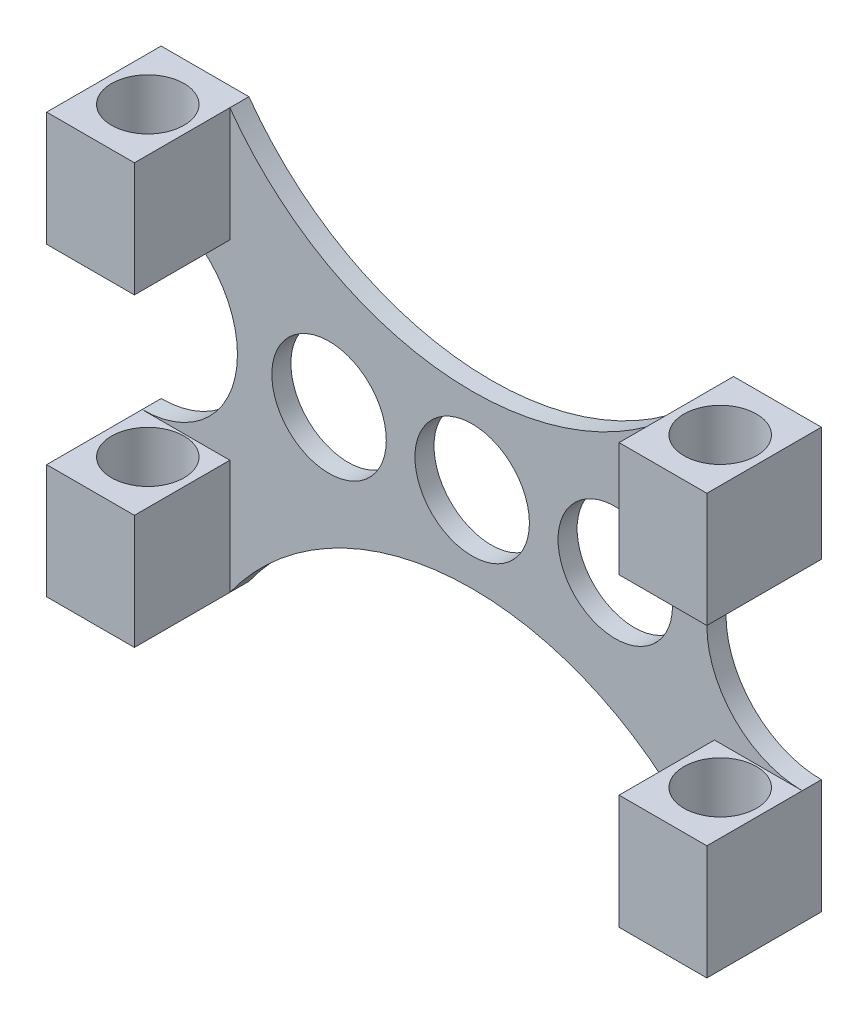
from build123d import *

# Parameters (mm, degrees)
SKETCH1_R           = 15
BOSS_EXTRUDE1_DEPTH = 5
SKETCH2_W           = 23
SKETCH2_H           = 30
SKETCH2_W_2         = 23.001410072
BOSS_EXTRUDE2_DEPTH = 25
CUT_EXTRUDE1_REACH  = 168.903
SKETCH3_R           = 9.5


with BuildPart() as part:
    # Sketch1 → Boss-Extrude1 (new body)
    with BuildSketch(Plane.XY):
        with BuildLine():
            Line((-51.112042928, 5.109070396), (-28.112042928, 5.109070396))
            ThreePointArc((-28.112042928, 5.109070396), (35.387957072, -27.503737277), (98.887957072, 5.109070396))
            Line((98.887957072, 5.109070396), (121.887957072, 5.109070396))
            Line((121.887957072, 5.109070396), (121.887957072, -24.890929604))
            ThreePointArc((121.887957072, -24.890929604), (96.887957072, -49.890929604), (121.887957072, -74.890929604))
            Line((121.887957072, -74.890929604), (121.887957072, -104.890929604))
            Line((121.887957072, -104.890929604), (98.887957072, -104.890929604))
            ThreePointArc((98.887957072, -104.890929604), (35.387957072, -72.278121931), (-28.112042928, -104.890929604))
            Line((-28.112042928, -104.890929604), (-51.112042928, -104.890929604))
            Line((-51.112042928, -104.890929604), (-51.112042928, -74.890929604))
            ThreePointArc((-51.112042928, -74.890929604), (-26.112042928, -49.890929604), (-51.112042928, -24.890929604))
            Line((-51.112042928, -24.890929604), (-51.112042928, 5.109070396))
        make_face()
        with Locations((35.387957072, -49.890929604)):
            Circle(SKETCH1_R, mode=Mode.SUBTRACT)
        with Locations((72.887957072, -49.890929604)):
            Circle(SKETCH1_R, mode=Mode.SUBTRACT)
        with Locations((-2.112042928, -49.890929604)):
            Circle(SKETCH1_R, mode=Mode.SUBTRACT)
    extrude(amount=BOSS_EXTRUDE1_DEPTH)

    # Sketch2 → Boss-Extrude2 (add)
    with BuildSketch(Plane.XY.offset(5)):
        with Locations((-39.612042928, -9.890929604)):
            Rectangle(SKETCH2_W, SKETCH2_H)
        with Locations((110.387252036, -9.890929604)):
            Rectangle(SKETCH2_W_2, SKETCH2_H)
        with Locations((110.387252036, -89.890929604)):
            Rectangle(SKETCH2_W_2, SKETCH2_H)
        with Locations((-39.612042928, -89.890929604)):
            Rectangle(SKETCH2_W, SKETCH2_H)
    extrude(amount=BOSS_EXTRUDE2_DEPTH)

    # Cut-Extrude1: up to this face of the body (flat: up to its plane)
    cut_extrude1_end = Plane(part.part.faces().sort_by_distance((-39.612042928, 5.109070396, 15))[0])
    # Sketch3 → Cut-Extrude1 (cut, up to the picked face)
    with BuildSketch(Plane.XZ.offset(104.890929604), mode=Mode.PRIVATE) as cut_extrude1_sk1:
        with Locations(Location((110.387604554, 15, 0), (0, 0, 270))):
            Circle(SKETCH3_R)
    cut_extrude1_tool1 = split(extrude(cut_extrude1_sk1.sketch, amount=-CUT_EXTRUDE1_REACH, mode=Mode.PRIVATE), bisect_by=cut_extrude1_end, keep=Keep.BOTH, mode=Mode.PRIVATE)
    # Sketch3 → Cut-Extrude1 (cut, up to the picked face)
    with BuildSketch(Plane.XZ.offset(104.890929604), mode=Mode.PRIVATE) as cut_extrude1_sk2:
        with Locations(Location((-39.612042928, 15, 0), (0, 0, 270))):
            Circle(SKETCH3_R)
    cut_extrude1_tool2 = split(extrude(cut_extrude1_sk2.sketch, amount=-CUT_EXTRUDE1_REACH, mode=Mode.PRIVATE), bisect_by=cut_extrude1_end, keep=Keep.BOTH, mode=Mode.PRIVATE)
    add(cut_extrude1_tool1.solids().sort_by(Axis((110.387605, -104.89093, 15), (0, 1, 0)))[0], mode=Mode.SUBTRACT)
    add(cut_extrude1_tool2.solids().sort_by(Axis((-39.612043, -104.89093, 15), (0, 1, 0)))[0], mode=Mode.SUBTRACT)


solid = part.part
